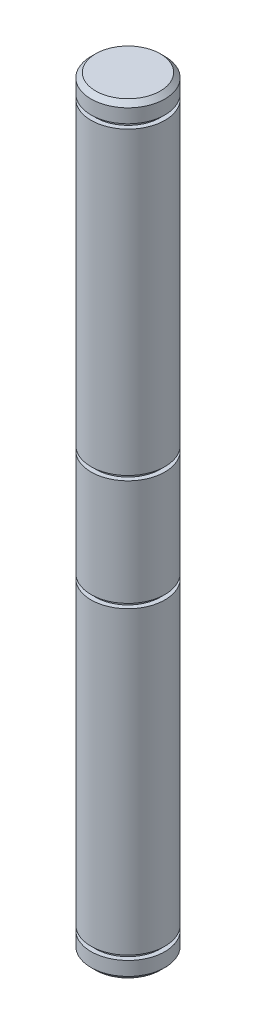
from build123d import *

# Parameters (mm, degrees)
CHAMFER1_SIZE = 1


with BuildPart() as part:
    # Sketch2 → Revolve1 (revolve)
    with BuildSketch(Plane.XY, mode=Mode.PRIVATE) as revolve1_sk:
        Polygon((0, 0), (8, 0), (8, 11.5), (7, 11.5), (7, 12.5), (8, 12.5), (8, 77.5), (7, 77.5), (7, 78.5), (8, 78.5), (8, 82.5), (0, 82.5), align=None)
    revolve1 = revolve(revolve1_sk.sketch.rotate(Axis((0, 82.5, 0), (0, -1, 0)), 180), axis=Axis((0, 82.5, 0), (0, -1, 0)))

    # Mirror1: Revolve1 across plane
    add(revolve1.mirror(Plane.ZX))

    # Chamfer1
    chamfer1_edges = [part.edges().sort_by_distance(p)[0] for p in [
        (8, -82.5, 0),
        (8, 82.5, 0),
    ]]
    chamfer(chamfer1_edges, length=CHAMFER1_SIZE)


solid = part.part
